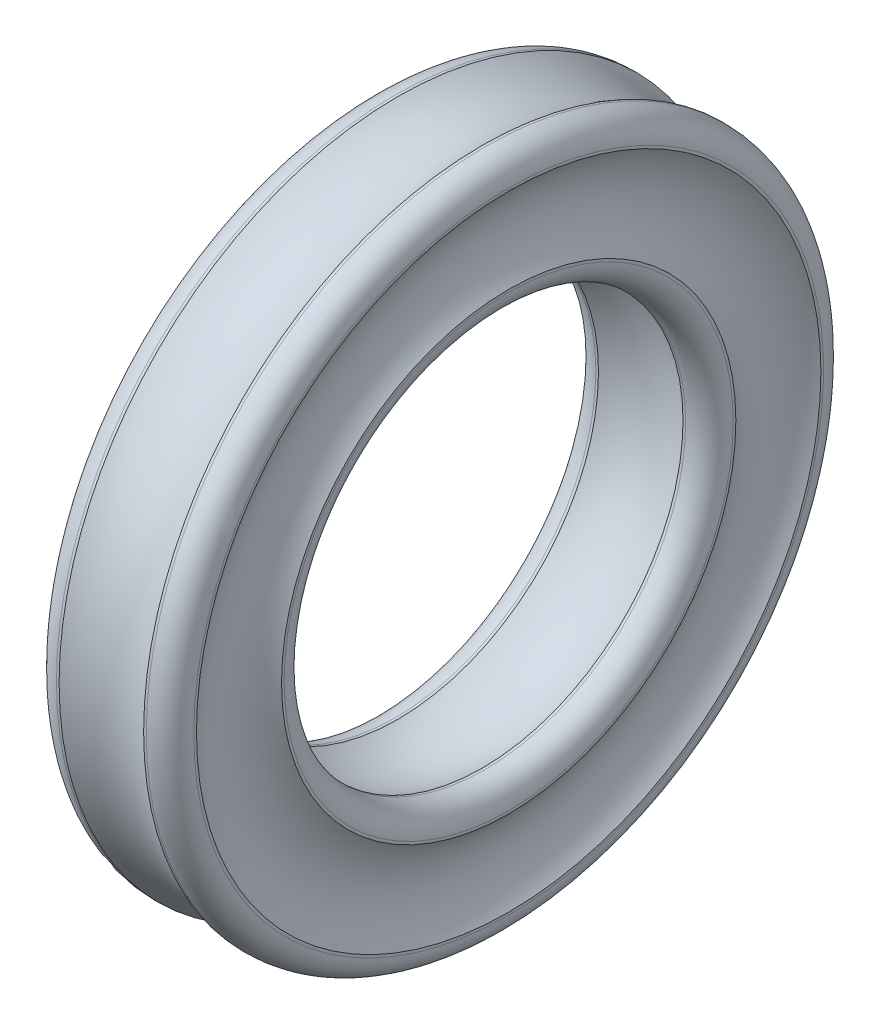
from build123d import *

# Parameters (mm, degrees)
FILLET1_R = 0.45


with BuildPart() as part:
    # Sketch1 → Revolve1 (revolve)
    with BuildSketch(Plane.XY, mode=Mode.PRIVATE) as revolve1_sk:
        with BuildLine():
            Line((-1.3, 3.8), (-0.8, 3.8))
            ThreePointArc((-0.8, 3.8), (0, 4.014779407), (0.8, 3.8))
            Line((0.8, 3.8), (1.3, 3.8))
            Line((1.3, 3.8), (1.3, 4.3))
            ThreePointArc((1.3, 4.3), (1.024345985, 5.105), (1.3, 5.91))
            Line((1.3, 5.91), (1.3, 6.41))
            Line((1.3, 6.41), (0.8, 6.41))
            ThreePointArc((0.8, 6.41), (0, 6.195220593), (-0.8, 6.41))
            Line((-0.8, 6.41), (-1.3, 6.41))
            Line((-1.3, 6.41), (-1.3, 5.91))
            ThreePointArc((-1.3, 5.91), (-1.030104508, 5.105), (-1.3, 4.3))
            Line((-1.3, 4.3), (-1.3, 3.8))
        make_face()
    revolve(revolve1_sk.sketch.rotate(Axis((0, 0, 0), (1, 0, 0)), 90), axis=Axis((0, 0, 0), (1, 0, 0)))

    # Fillet1
    fillet1_edges = [part.edges().sort_by_distance(p)[0] for p in [
        (-1.3, 0, -3.8),
        (-1.3, 0, -6.41),
        (1.3, 0, -6.41),
        (1.3, 0, -3.8),
    ]]
    fillet(fillet1_edges, radius=FILLET1_R)


solid = part.part
